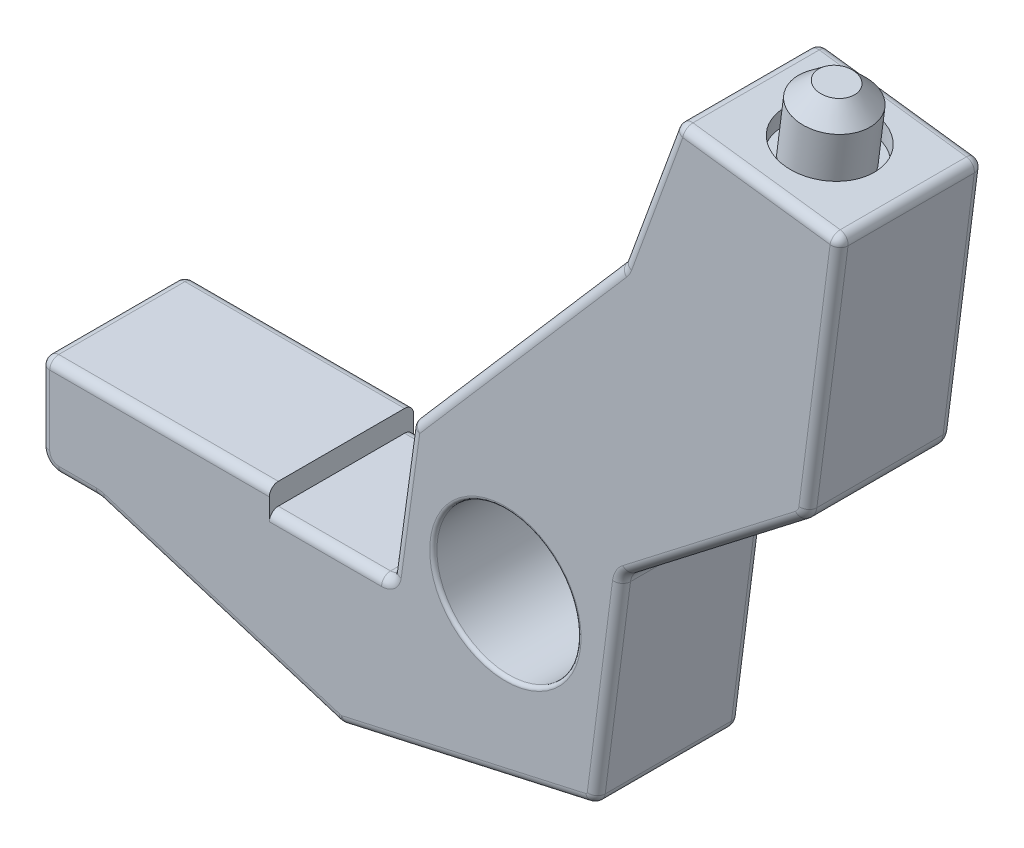
from build123d import *

# Parameters (mm, degrees)
SKETCH_1_R          = 4
EXTRUDE_1_DEPTH     = 8
SKETCH_2_R          = 2
EXTRUDE_2_DEPTH     = 3
CHAMFER_1_SIZE      = 1
FILLET_1_R          = 0.2
CUT_EXTRUDE_START   = -1
SKETCH_3_R          = 2.5
SKETCH_3_R_2        = 2
CUT_EXTRUDE_1_DEPTH = 1
FILLET_2_R          = 0.5


with BuildPart() as part:
    # 스케치1 → 보스-돌출1 (new body)
    with BuildSketch(Plane.XY):
        with BuildLine():
            Line((18.503045264, 25.710400876), (16.774192381, 12.269481729))
            ThreePointArc((16.774192381, 12.269481729), (16.649873032, 11.899636309), (16.393483216, 11.605518651))
            Line((16.393483216, 11.605518651), (6.818985785, 4.213374054))
            ThreePointArc((6.818985785, 4.213374054), (6.562595969, 3.919256395), (6.43827662, 3.549410976))
            Line((6.43827662, 3.549410976), (5.036897025, -7.345576114))
            ThreePointArc((5.036897025, -7.345576114), (4.885123304, -7.67333808), (4.572690124, -7.854580118))
            Line((4.572690124, -7.854580118), (-8.955561464, -10.878611884))
            ThreePointArc((-8.955561464, -10.878611884), (-9.059146158, -10.892441175), (-9.163559205, -10.888087594))
            ThreePointArc((-9.163559205, -10.888087594), (-9.247925369, -10.873458379), (-9.330730781, -10.851665551))
            Line((-9.330730781, -10.851665551), (-22.39641752, -6.807524417))
            ThreePointArc((-22.39641752, -6.807524417), (-22.542578492, -6.774052023), (-22.692101248, -6.762810308))
            Line((-22.692101248, -6.762810308), (-24.7735417, -6.762810308))
            ThreePointArc((-24.7735417, -6.762810308), (-25.480648481, -6.469917089), (-25.7735417, -5.762810308))
            Line((-25.7735417, -5.762810308), (-25.7735417, -1.895501216))
            ThreePointArc((-25.7735417, -1.895501216), (-25.62709509, -1.541947825), (-25.2735417, -1.395501216))
            Line((-25.2735417, -1.395501216), (-13.092668434, -1.395501216))
            Line((-13.092668434, -1.395501216), (-13.092668434, -2.589456262))
            Line((-13.092668434, -2.589456262), (-6.869177412, -2.589456262))
            ThreePointArc((-6.869177412, -2.589456262), (-6.474967763, -2.441782198), (-6.274806584, -2.071452104))
            Line((-6.274806584, -2.071452104), (-5.245859717, 5.387170068))
            ThreePointArc((-5.245859717, 5.387170068), (-5.205979224, 5.525201179), (-5.128493011, 5.646192616))
            Line((-5.128493011, 5.646192616), (6.347898488, 18.896175834))
            ThreePointArc((6.347898488, 18.896175834), (6.453984658, 19.043922748), (6.53155388, 19.208441568))
            Line((6.53155388, 19.208441568), (9.369909955, 26.995955233))
            ThreePointArc((9.369909955, 26.995955233), (9.579752789, 27.251863138), (9.903467507, 27.320650143))
            Line((9.903467507, 27.320650143), (18.070918344, 26.270102873))
            ThreePointArc((18.070918344, 26.270102873), (18.402899883, 26.07974829), (18.503045264, 25.710400876))
        make_face()
        Circle(SKETCH_1_R, mode=Mode.SUBTRACT)
    extrude(amount=EXTRUDE_1_DEPTH)

    # 스케치2 → 보스-돌출2 (add)
    with BuildSketch(Plane(origin=(3.618137143, 28.129107616, 0), x_dir=(0.9918289166876348, -0.1275750760228385, 0), z_dir=(0.1275750760228385, 0.9918289166876348, 0))):
        with Locations((10.454480212, -4)):
            Circle(SKETCH_2_R)
    extrude(amount=EXTRUDE_2_DEPTH)

    # 모따기1
    chamfer_1_edges = [part.edges().sort_by_distance(p)[0] for p in [
        (12.38626032, 30.02601341, 4),
    ]]
    chamfer(chamfer_1_edges, length=CHAMFER_1_SIZE)

    # 필렛1
    fillet_1_edges = [part.edges().sort_by_distance(p)[0] for p in [
        (-4, 0, 0),
        (-4, 0, 8),
    ]]
    fillet(fillet_1_edges, radius=FILLET_1_R)

    # 스케치3 → 컷-돌출1 (cut)
    with BuildSketch(Plane(origin=(3.618137143, 28.129107616, 0), x_dir=(0.9918289166876348, -0.1275750760228385, 0), z_dir=(0.1275750760228385, 0.9918289166876348, 0)).offset(CUT_EXTRUDE_START)):
        with Locations(Location((10.454480212, -4, 0), (0, 0, 180))):
            Circle(SKETCH_3_R)
        with Locations(Location((10.454480212, -4, 0), (0, 0, 180))):
            Circle(SKETCH_3_R_2, mode=Mode.SUBTRACT)
    extrude(amount=CUT_EXTRUDE_1_DEPTH, mode=Mode.SUBTRACT)

    # 필렛2
    fillet_2_edges = [part.edges().sort_by_distance(p)[0] for p in [
        (6.562595969, 3.919256395, 8),
        (11.606234501, 7.909446352, 8),
        (16.649873032, 11.899636309, 8),
        (17.638618823, 18.989941303, 8),
        (18.402899883, 26.07974829, 8),
        (-2.19143567, -9.366596001, 0),
        (-9.059146158, -10.892441175, 0),
        (-9.247925369, -10.873458379, 0),
        (-15.86357415, -8.829594984, 0),
        (-22.542578492, -6.774052023, 0),
        (-23.732821474, -6.762810308, 0),
        (13.987192925, 26.795376508, 8),
        (-25.480648481, -6.469917089, 0),
        (-25.7735417, -3.829155762, 0),
        (-25.62709509, -1.541947825, 0),
        (-19.183105067, -1.395501216, 0),
        (-9.980922923, -2.589456262, 0),
        (-6.474967763, -2.441782198, 0),
        (9.579752789, 27.251863138, 8),
        (-5.76033315, 1.657858982, 0),
        (-5.205979224, 5.525201179, 0),
        (0.609702738, 12.271184225, 0),
        (6.453984658, 19.043922748, 0),
        (7.950731917, 23.102198401, 0),
        (9.579752789, 27.251863138, 0),
        (13.987192925, 26.795376508, 0),
        (18.402899883, 26.07974829, 0),
        (7.950731917, 23.102198401, 8),
        (17.638618823, 18.989941303, 0),
        (16.649873032, 11.899636309, 0),
        (11.606234501, 7.909446352, 0),
        (6.562595969, 3.919256395, 0),
        (5.737586822, -1.898082569, 0),
        (4.885123304, -7.67333808, 0),
        (6.453984658, 19.043922748, 8),
        (0.609702738, 12.271184225, 8),
        (4.885123304, -7.67333808, 8),
        (-5.205979224, 5.525201179, 8),
        (-5.76033315, 1.657858982, 8),
        (-6.474967763, -2.441782198, 8),
        (-9.980922923, -2.589456262, 8),
        (-19.183105067, -1.395501216, 8),
        (-25.62709509, -1.541947825, 8),
        (-25.7735417, -3.829155762, 8),
        (-25.480648481, -6.469917089, 8),
        (-23.732821474, -6.762810308, 8),
        (5.737586822, -1.898082569, 8),
        (-22.542578492, -6.774052023, 8),
        (-15.86357415, -8.829594984, 8),
        (-9.247925369, -10.873458379, 8),
        (-9.059146158, -10.892441175, 8),
        (-2.19143567, -9.366596001, 8),
    ]]
    fillet(fillet_2_edges, radius=FILLET_2_R)


solid = part.part
